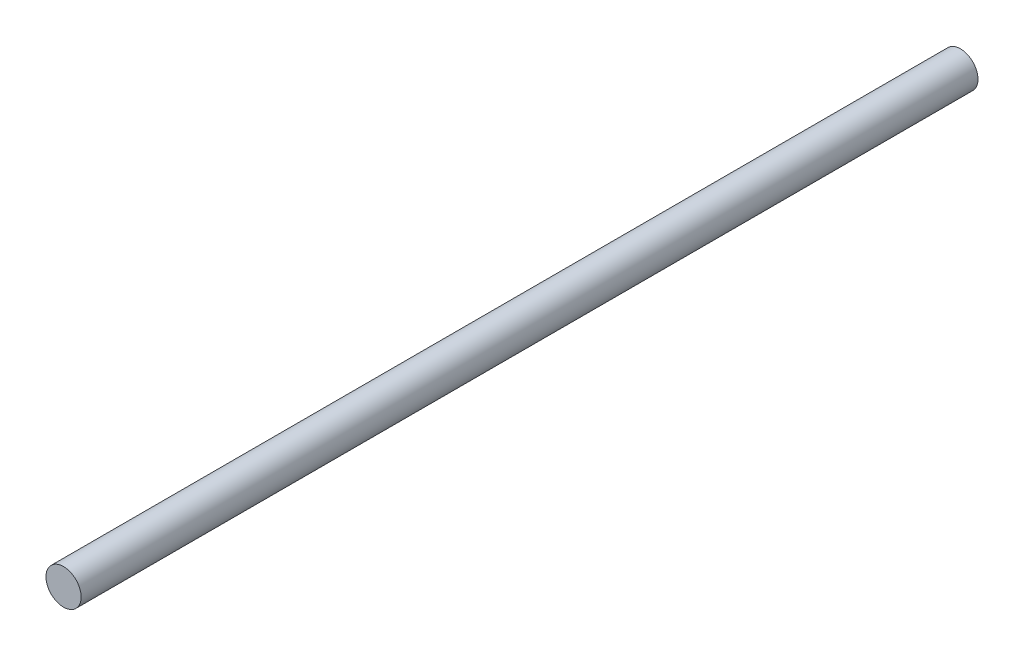
from build123d import *

# Parameters (mm, degrees)
SKETCH1_R           = 5
BOSS_EXTRUDE1_DEPTH = 255


with BuildPart() as part:
    # Sketch1 → Boss-Extrude1 (new body)
    with BuildSketch(Plane.XY):
        Circle(SKETCH1_R)
    extrude(amount=BOSS_EXTRUDE1_DEPTH)


solid = part.part
